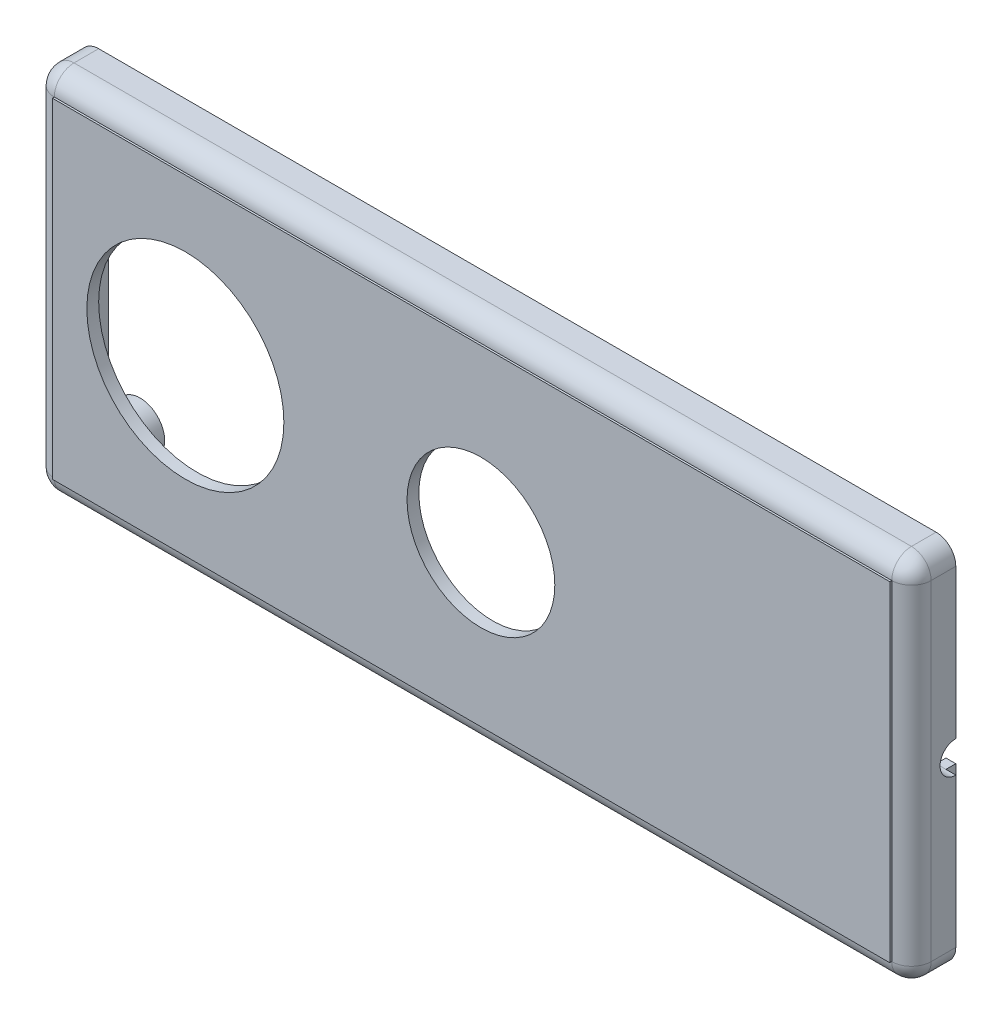
from build123d import *

# Parameters (mm, degrees)
SKETCH_1_W           = 89
SKETCH_1_H           = 37.5
EXTRUDE_1_DEPTH      = 4.5
SKETCH_2_W           = 85
SKETCH_2_H           = 33.5
CUT_EXTRUDE_1_DEPTH  = 3.5
CUT_EXTRUDE_3_DEPTH  = 4
FILLET_1_R           = 2
EXTRUDE_2_DEPTH      = 1
SKETCH_10_R          = 2.5
EXTRUDE_3_DEPTH      = 4.5
SKETCH_11_R          = 0.79
CUT_EXTRUDE_9_DEPTH  = 3
SKETCH_12_W          = 85
SKETCH_12_H          = 33.5
EXTRUDE_4_DEPTH      = 0.2
SKETCH_8_R           = 7.5
CUT_EXTRUDE_8_DEPTH  = 3
SKETCH_7_R           = 10
CUT_EXTRUDE_7_DEPTH  = 3
CUT_EXTRUDE_12_DEPTH = 3.8


with BuildPart() as part:
    # 草图1 → 凸台-拉伸1 (new body)
    with BuildSketch(Plane.XY):
        Rectangle(SKETCH_1_W, SKETCH_1_H)
    extrude(amount=EXTRUDE_1_DEPTH)

    # 草图2 → 切除-拉伸1 (cut)
    with BuildSketch(Plane(origin=(0, 0, 0), x_dir=(-1, 0, 0), z_dir=(0, 0, -1))):
        Rectangle(SKETCH_2_W, SKETCH_2_H)
    extrude(amount=-CUT_EXTRUDE_1_DEPTH, mode=Mode.SUBTRACT)

    # 草图3 → 切除-拉伸3 (cut)
    with BuildSketch(Plane(origin=(44.5, 0, 0), x_dir=(0, 0, -1), z_dir=(1, 0, 0))):
        with BuildLine():
            Line((0, 1.6), (0, -1.6))
            ThreePointArc((0, -1.6), (-1.6, 0), (0, 1.6))
        make_face()
    extrude(amount=-CUT_EXTRUDE_3_DEPTH, mode=Mode.SUBTRACT)

    # 圆角1
    fillet_1_edges = [part.edges().sort_by_distance(p)[0] for p in [
        (-44.5, 0, 4.5),
        (0, -18.75, 4.5),
        (42.5, -16.75, 1.75),
        (42.5, 16.75, 1.75),
        (-42.5, 16.75, 1.75),
        (-42.5, -16.75, 1.75),
        (44.5, 0, 4.5),
        (0, 18.75, 4.5),
        (44.5, -18.75, 2.25),
        (-44.5, -18.75, 2.25),
        (-44.5, 18.75, 2.25),
        (44.5, 18.75, 2.25),
    ]]
    fillet(fillet_1_edges, radius=FILLET_1_R)

    # 草图9 → 凸台-拉伸2 (add)
    with BuildSketch(Plane(origin=(0, 0, 0), x_dir=(-1, 0, 0), z_dir=(0, 0, -1))):
        with BuildLine():
            Line((-41.5, 17.75), (41.5, 17.75))
            ThreePointArc((41.5, 17.75), (42.914213562, 17.164213562), (43.5, 15.75))
            Line((43.5, 15.75), (43.5, -15.75))
            ThreePointArc((43.5, -15.75), (42.914213562, -17.164213562), (41.5, -17.75))
            Line((41.5, -17.75), (-41.5, -17.75))
            ThreePointArc((-41.5, -17.75), (-42.914213562, -17.164213562), (-43.5, -15.75))
            Line((-43.5, -15.75), (-43.5, -1.6))
            Line((-43.5, -1.6), (-42.5, -1.6))
            Line((-42.5, -1.6), (-42.5, -14.75))
            ThreePointArc((-42.5, -14.75), (-41.914213562, -16.164213562), (-40.5, -16.75))
            Line((-40.5, -16.75), (40.5, -16.75))
            ThreePointArc((40.5, -16.75), (41.914213562, -16.164213562), (42.5, -14.75))
            Line((42.5, -14.75), (42.5, 14.75))
            ThreePointArc((42.5, 14.75), (41.914213562, 16.164213562), (40.5, 16.75))
            Line((40.5, 16.75), (-40.5, 16.75))
            ThreePointArc((-40.5, 16.75), (-41.914213562, 16.164213562), (-42.5, 14.75))
            Line((-42.5, 14.75), (-42.5, 1.6))
            Line((-42.5, 1.6), (-43.5, 1.6))
            Line((-43.5, 1.6), (-43.5, 15.75))
            ThreePointArc((-43.5, 15.75), (-42.914213562, 17.164213562), (-41.5, 17.75))
        make_face()
    extrude(amount=EXTRUDE_2_DEPTH)

    # 草图10 → 凸台-拉伸3 (add)
    with BuildSketch(Plane(origin=(0, 0, 3.5), x_dir=(-1, 0, 0), z_dir=(0, 0, -1))):
        with Locations((39.3, -13.35)):
            Circle(SKETCH_10_R)
        with Locations((39.3, 13.35)):
            Circle(SKETCH_10_R)
        with Locations((-34.5, 13.35)):
            Circle(SKETCH_10_R)
        with Locations((-34.5, -13.35)):
            Circle(SKETCH_10_R)
    extrude(amount=EXTRUDE_3_DEPTH)

    # 草图11 → 切除-拉伸9 (cut)
    with BuildSketch(Plane(origin=(0, 0, -1), x_dir=(-1, 0, 0), z_dir=(0, 0, -1))):
        with Locations((-34.5, 13.35)):
            Circle(SKETCH_11_R)
        with Locations((-34.5, -13.35)):
            Circle(SKETCH_11_R)
        with Locations((39.3, 13.35)):
            Circle(SKETCH_11_R)
        with Locations((39.3, -13.35)):
            Circle(SKETCH_11_R)
    extrude(amount=-CUT_EXTRUDE_9_DEPTH, mode=Mode.SUBTRACT)

    # 草图12 → 凸台-拉伸4 (add)
    with BuildSketch(Plane.XY.offset(4.5)):
        Rectangle(SKETCH_12_W, SKETCH_12_H)
    extrude(amount=EXTRUDE_4_DEPTH)

    # 草图8 → 切除-拉伸8 (cut)
    with BuildSketch(Plane(origin=(0, 0, 3.5), x_dir=(-1, 0, 0), z_dir=(0, 0, -1))):
        with Locations((-1, -0.55)):
            Circle(SKETCH_8_R)
    extrude(amount=-CUT_EXTRUDE_8_DEPTH, mode=Mode.SUBTRACT)

    # 草图7 → 切除-拉伸7 (cut)
    with BuildSketch(Plane(origin=(0, 0, 3.5), x_dir=(-1, 0, 0), z_dir=(0, 0, -1))):
        with Locations((29, 0)):
            Circle(SKETCH_7_R)
    extrude(amount=-CUT_EXTRUDE_7_DEPTH, mode=Mode.SUBTRACT)

    # 草图15 → 切除-拉伸12 (cut)
    with BuildSketch(Plane(origin=(0, 0, -1), x_dir=(-1, 0, 0), z_dir=(0, 0, -1))):
        Polygon((-27.5, -18.75), (-14.5, -18.75), (-13.5, -16.75), (-28.5, -16.75), align=None)
    extrude(amount=-CUT_EXTRUDE_12_DEPTH, mode=Mode.SUBTRACT)


solid = part.part
